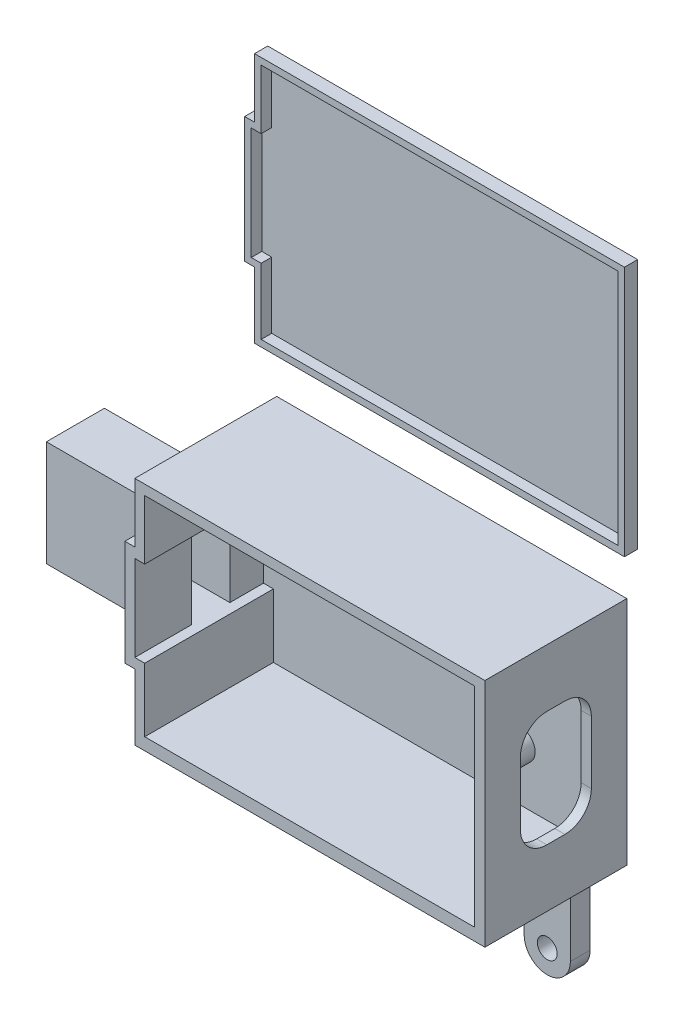
from build123d import *

# Parameters (mm, degrees)
SALIENTE_EXTRUIR1_DEPTH  = 23
CROQUIS2_W               = 53.038770051
CROQUIS2_H               = 35
SALIENTE_EXTRUIR2_DEPTH  = 1.5
CORTAR_EXTRUIR1_REACH    = 63.727
CROQUIS3_W               = 20.5
CROQUIS3_H               = 8.6
SALIENTE_EXTRUIR4_DEPTH  = 16
CORTAR_EXTRUIR5_REACH    = 68.41
CROQUIS12_W              = 49.5
CROQUIS12_H              = 5
SALIENTE_EXTRUIR14_DEPTH = 2
AGUJEROS_R               = 1.5
CORTAR_EXTRUIR12_DEPTH   = 3.5
CROQUIS29_R              = 2.298318417
CROQUIS29_R_2            = 1.5
CROQUIS29_R_3            = 2.25
SALIENTE_EXTRUIR15_DEPTH = 3.5
CROQUIS27_W              = 50
CROQUIS27_H              = 4.65287556
CORTAR_EXTRUIR15_DEPTH   = 19.5
CROQUIS30_W              = 3
CROQUIS30_H              = 35
CORTAR_EXTRUIR17_DEPTH   = 5.038770051
SALIENTE_EXTRUIR16_DEPTH = 2
CORTAR_EXTRUIR19_DEPTH   = 1.6
CORTAR_EXTRUIR20_DEPTH   = 1.538770051
CROQUIS35_R              = 1.5
SALIENTE_EXTRUIR17_DEPTH = 3


with BuildPart() as part:
    # Croquis1 → Saliente-Extruir1 (new body)
    with BuildSketch(Plane.XY):
        Polygon((51.538770051, -6.5), (-1.5, -6.5), (-1.5, 3.5), (-22, 3.5), (-22, 5), (0, 5), (0, 0), (50, 0), (50, 27), (0, 27), (0, 18), (-22, 18), (-22, 19.5), (-1.5, 19.5), (-1.5, 28.5), (51.538770051, 28.5), align=None)
    extrude(amount=SALIENTE_EXTRUIR1_DEPTH)

    # Croquis2 → Saliente-Extruir2 (add)
    with BuildSketch(Plane(origin=(0, 0, 0), x_dir=(-1, 0, 0), z_dir=(0, 0, -1))):
        with Locations((-25.019385026, 11)):
            Rectangle(CROQUIS2_W, CROQUIS2_H)
    extrude(amount=SALIENTE_EXTRUIR2_DEPTH)

    # Cortar-Extruir1: up to this face of the body (flat: up to its plane)
    cortar_extruir1_end = Plane(part.part.faces().sort_by_distance((-11.75, 19.5, 11.5))[0])
    # Croquis3 → Cortar-Extruir1 (cut, up to the picked face)
    with BuildSketch(Plane.XZ.offset(-3.5), mode=Mode.PRIVATE) as cortar_extruir1_sk1:
        with Locations((-11.75, 18.7)):
            Rectangle(CROQUIS3_W, CROQUIS3_H)
    cortar_extruir1_tool1 = split(extrude(cortar_extruir1_sk1.sketch, amount=-CORTAR_EXTRUIR1_REACH, mode=Mode.PRIVATE), bisect_by=cortar_extruir1_end, keep=Keep.BOTH, mode=Mode.PRIVATE)
    # Croquis3 → Cortar-Extruir1 (cut, up to the picked face)
    with BuildSketch(Plane.XZ.offset(-3.5), mode=Mode.PRIVATE) as cortar_extruir1_sk2:
        with Locations((-11.75, 4.3)):
            Rectangle(CROQUIS3_W, CROQUIS3_H)
    cortar_extruir1_tool2 = split(extrude(cortar_extruir1_sk2.sketch, amount=-CORTAR_EXTRUIR1_REACH, mode=Mode.PRIVATE), bisect_by=cortar_extruir1_end, keep=Keep.BOTH, mode=Mode.PRIVATE)
    add(cortar_extruir1_tool1.solids().sort_by(Axis((-11.75, 3.5, 18.7), (0, 1, 0)))[0], mode=Mode.SUBTRACT)
    add(cortar_extruir1_tool2.solids().sort_by(Axis((-11.75, 3.5, 4.3), (0, 1, 0)))[0], mode=Mode.SUBTRACT)

    # Croquis4 → Saliente-Extruir4 (add)
    with BuildSketch(Plane.XZ.offset(-3.5)):
        Polygon((-22, 14.4), (-1.5, 14.4), (-1.5, 23), (-3, 23), (-3, 15.9), (-22, 15.9), align=None)
        Polygon((-22, 8.6), (-1.5, 8.6), (-1.5, -1.5), (-3, -1.5), (-3, 7.1), (-22, 7.1), align=None)
    extrude(amount=-SALIENTE_EXTRUIR4_DEPTH)

    # Cortar-Extruir5: up to this face of the body (flat: up to its plane)
    cortar_extruir5_end = Plane(part.part.faces().sort_by_distance((25.019385026, 28.5, 10.75))[0])
    # Croquis12 → Cortar-Extruir5 (cut, up to the picked face)
    with BuildSketch(Plane.XZ.offset(6.5), mode=Mode.PRIVATE) as cortar_extruir5_sk1:
        with Locations((21.75, 1)):
            Rectangle(CROQUIS12_W, CROQUIS12_H)
    cortar_extruir5_tool1 = split(extrude(cortar_extruir5_sk1.sketch, amount=-CORTAR_EXTRUIR5_REACH, mode=Mode.PRIVATE), bisect_by=cortar_extruir5_end, keep=Keep.BOTH, mode=Mode.PRIVATE)
    add(cortar_extruir5_tool1.solids().sort_by(Axis((21.75, -6.5, 1), (0, 1, 0)))[0], mode=Mode.SUBTRACT)

    # Croquis14 → Saliente-Extruir14 (add)
    with BuildSketch(Plane(origin=(0, 0, 3.5), x_dir=(-1, 0, 0), z_dir=(0, 0, -1))):
        Polygon((1.5, 3.5), (1.5, -6.5), (-51.538770051, -6.5), (-51.538770051, 28.5), (1.5, 28.5), (1.5, 19.5), (3, 19.5), (3, 3.5), align=None)
    extrude(amount=SALIENTE_EXTRUIR14_DEPTH)

    # Agujeros → Cortar-Extruir12 (cut)
    with BuildSketch(Plane.XY):
        with Locations(Location((37.4, 3.4, 0), (0, 0, 180))):
            Circle(AGUJEROS_R)
        with Locations(Location((7.3, 18.8, 0), (0, 0, 180))):
            Circle(AGUJEROS_R)
    extrude(amount=CORTAR_EXTRUIR12_DEPTH, mode=Mode.SUBTRACT)

    # Croquis29 → Saliente-Extruir15 (add)
    # profile 1 of 2: a face of its own
    with BuildSketch(Plane.XY.offset(3.5)):
        with Locations(Location((7.3, 18.8, 0), (0, 0, 180))):
            Circle(CROQUIS29_R)
        with Locations(Location((7.3, 18.8, 0), (0, 0, 180))):
            Circle(CROQUIS29_R_2, mode=Mode.SUBTRACT)
    # profile 2 of 2: a face of its own
    with BuildSketch(Plane.XY.offset(3.5)):
        with Locations(Location((37.4, 3.4, 0), (0, 0, 180))):
            Circle(CROQUIS29_R_3)
        with Locations(Location((37.4, 3.4, 0), (0, 0, 180))):
            Circle(CROQUIS29_R_2, mode=Mode.SUBTRACT)
    extrude(amount=SALIENTE_EXTRUIR15_DEPTH)

    # Croquis27 → Cortar-Extruir15 (cut)
    with BuildSketch(Plane.XY.offset(23)):
        with Locations((25, -2.32643778)):
            Rectangle(CROQUIS27_W, CROQUIS27_H)
    extrude(amount=-CORTAR_EXTRUIR15_DEPTH, mode=Mode.SUBTRACT)

    # Croquis30 → Cortar-Extruir17 (cut)
    with BuildSketch(Plane.ZY.offset(-46.5)):
        with Locations((0, 11)):
            Rectangle(CROQUIS30_W, CROQUIS30_H)
    extrude(amount=-CORTAR_EXTRUIR17_DEPTH, mode=Mode.SUBTRACT)

    # Croquis34 → Cortar-Extruir20 (cut)
    with BuildSketch(Plane(origin=(51.538770051, 0, 0), x_dir=(0, 0, -1), z_dir=(1, 0, 0))):
        with BuildLine():
            Line((-13.625, 19.75), (-10.875, 19.75))
            ThreePointArc((-10.875, 19.75), (-8.046572875, 18.578427125), (-6.875, 15.75))
            Line((-6.875, 15.75), (-6.875, 6.25))
            ThreePointArc((-6.875, 6.25), (-8.046572875, 3.421572875), (-10.875, 2.25))
            Line((-10.875, 2.25), (-13.625, 2.25))
            ThreePointArc((-13.625, 2.25), (-16.453427125, 3.421572875), (-17.625, 6.25))
            Line((-17.625, 6.25), (-17.625, 15.75))
            ThreePointArc((-17.625, 15.75), (-16.453427125, 18.578427125), (-13.625, 19.75))
        make_face()
    extrude(amount=-CORTAR_EXTRUIR20_DEPTH, mode=Mode.SUBTRACT)

    # Croquis35 → Saliente-Extruir17 (add)
    # profile 1 of 2: a face of its own
    with BuildSketch(Plane(origin=(0, 0, 1.5), x_dir=(-1, 0, 0), z_dir=(0, 0, -1))):
        with BuildLine():
            Line((-38.987043205, -6.5), (-38.987043205, -20.396591545))
            ThreePointArc((-38.987043205, -20.396591545), (-42.487043205, -23.896591545), (-45.987043205, -20.396591545))
            Line((-45.987043205, -20.396591545), (-45.987043205, -6.5))
            Line((-45.987043205, -6.5), (-38.987043205, -6.5))
        make_face()
        with Locations((-42.487043205, -20.396591545)):
            Circle(CROQUIS35_R, mode=Mode.SUBTRACT)
    # profile 2 of 2: a face of its own
    with BuildSketch(Plane(origin=(0, 0, 1.5), x_dir=(-1, 0, 0), z_dir=(0, 0, -1))):
        with BuildLine():
            Line((-4.233147567, -6.5), (-4.233147567, -20.396591545))
            ThreePointArc((-4.233147567, -20.396591545), (-7.733147567, -23.896591545), (-11.233147567, -20.396591545))
            Line((-11.233147567, -20.396591545), (-11.233147567, -6.5))
            Line((-11.233147567, -6.5), (-4.233147567, -6.5))
        make_face()
        with Locations((-7.733147567, -20.396591545)):
            Circle(CROQUIS35_R, mode=Mode.SUBTRACT)
    extrude(amount=-SALIENTE_EXTRUIR17_DEPTH)


with BuildPart() as body_2:
    # Croquis31 → Saliente-Extruir16 (new body)
    with BuildSketch(Plane(origin=(0, 0, 1.5), x_dir=(-1, 0, 0), z_dir=(0, 0, -1))):
        Polygon((4.358060316, 64.797154315), (4.358060316, 45.797154315), (2.858060316, 45.797154315), (2.858060316, 35.797154315), (-53.180709735, 35.797154315), (-53.180709735, 73.797154315), (2.858060316, 73.797154315), (2.858060316, 64.797154315), align=None)
    extrude(amount=-SALIENTE_EXTRUIR16_DEPTH)

    # Croquis32 → Cortar-Extruir19 (cut)
    with BuildSketch(Plane.XY.offset(3.5)):
        Polygon((-1.858060316, 46.797154315), (-1.858060316, 36.797154315), (52.180709735, 36.797154315), (52.180709735, 72.797154315), (-1.858060316, 72.797154315), (-1.858060316, 63.797154315), (-3.358060316, 63.797154315), (-3.358060316, 46.797154315), align=None)
    extrude(amount=-CORTAR_EXTRUIR19_DEPTH, mode=Mode.SUBTRACT)


solid = Compound([part.part, body_2.part])
